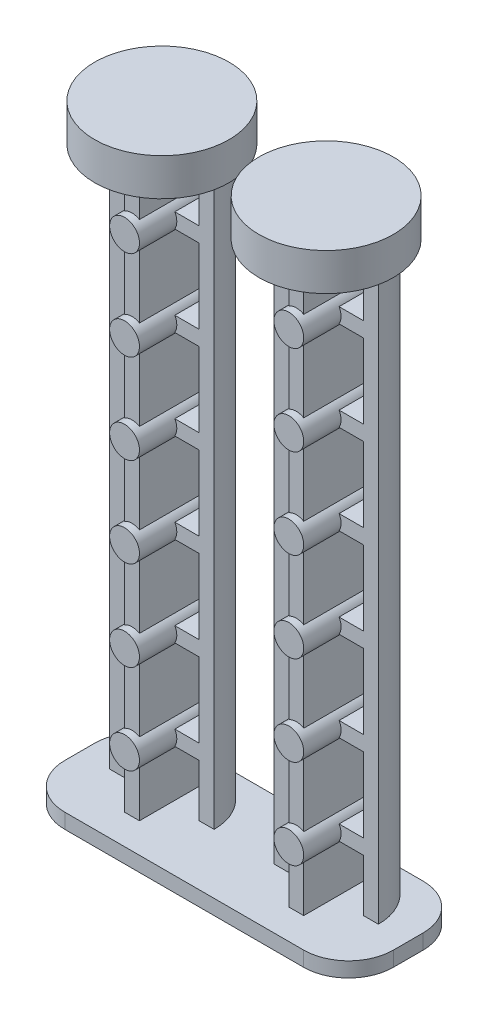
from build123d import *

# Parameters (mm, degrees)
SKETCH2_R           = 9
BOSS_EXTRUDE1_DEPTH = 5
BOSS_EXTRUDE2_DEPTH = 76
BOSS_EXTRUDE3_REACH = 86.599
SKETCH4_R           = 2
BOSS_EXTRUDE4_DEPTH = 2
RIB4_REACH          = 88.845
SKETCH9_WALLS_W     = 2
SKETCH9_WALLS_H     = 181.689377914
SKETCH9_WALLS_H_2   = 183.689377914
RIB5_REACH          = 88.337
SKETCH10_WALLS_W    = 177.673101554
SKETCH10_WALLS_H    = 2


with BuildPart() as part:
    # Sketch2 → Boss-Extrude1 (new body)
    with BuildSketch(Plane(origin=(0, 0, 0), x_dir=(1, 0, 0), z_dir=(0, 1, 0))):
        with Locations(Location((-11, 0, 0), (0, 0, 270))):
            Circle(SKETCH2_R)
    extrude(amount=-BOSS_EXTRUDE1_DEPTH)

    # Sketch3 → Boss-Extrude2 (add)
    with BuildSketch(Plane.XZ.offset(5)):
        with BuildLine():
            Line((-4, 0), (-6, 0))
            ThreePointArc((-6, 0), (-11, -5), (-16, 0))
            Line((-16, 0), (-18, 0))
            ThreePointArc((-18, 0), (-11, -7), (-4, 0))
        make_face()
    extrude(amount=BOSS_EXTRUDE2_DEPTH)

    # Sketch4 → Boss-Extrude3 (add, up to next)
    with BuildSketch(Plane.XY.offset(5), mode=Mode.PRIVATE) as boss_extrude3_sk1:
        with Locations((-11, -13)):
            Circle(SKETCH4_R)
    boss_extrude3_tool1 = extrude(boss_extrude3_sk1.sketch, amount=-BOSS_EXTRUDE3_REACH, mode=Mode.PRIVATE) - part.part
    # Sketch4 → Boss-Extrude3 (add, up to next)
    with BuildSketch(Plane.XY.offset(5), mode=Mode.PRIVATE) as boss_extrude3_sk2:
        with Locations((-11, -25)):
            Circle(SKETCH4_R)
    boss_extrude3_tool2 = extrude(boss_extrude3_sk2.sketch, amount=-BOSS_EXTRUDE3_REACH, mode=Mode.PRIVATE) - part.part
    # Sketch4 → Boss-Extrude3 (add, up to next)
    with BuildSketch(Plane.XY.offset(5), mode=Mode.PRIVATE) as boss_extrude3_sk3:
        with Locations((-11, -37)):
            Circle(SKETCH4_R)
    boss_extrude3_tool3 = extrude(boss_extrude3_sk3.sketch, amount=-BOSS_EXTRUDE3_REACH, mode=Mode.PRIVATE) - part.part
    # Sketch4 → Boss-Extrude3 (add, up to next)
    with BuildSketch(Plane.XY.offset(5), mode=Mode.PRIVATE) as boss_extrude3_sk4:
        with Locations((-11, -49)):
            Circle(SKETCH4_R)
    boss_extrude3_tool4 = extrude(boss_extrude3_sk4.sketch, amount=-BOSS_EXTRUDE3_REACH, mode=Mode.PRIVATE) - part.part
    # Sketch4 → Boss-Extrude3 (add, up to next)
    with BuildSketch(Plane.XY.offset(5), mode=Mode.PRIVATE) as boss_extrude3_sk5:
        with Locations((-11, -61)):
            Circle(SKETCH4_R)
    boss_extrude3_tool5 = extrude(boss_extrude3_sk5.sketch, amount=-BOSS_EXTRUDE3_REACH, mode=Mode.PRIVATE) - part.part
    # Sketch4 → Boss-Extrude3 (add, up to next)
    with BuildSketch(Plane.XY.offset(5), mode=Mode.PRIVATE) as boss_extrude3_sk6:
        with Locations((-11, -73)):
            Circle(SKETCH4_R)
    boss_extrude3_tool6 = extrude(boss_extrude3_sk6.sketch, amount=-BOSS_EXTRUDE3_REACH, mode=Mode.PRIVATE) - part.part
    add(boss_extrude3_tool1.solids().sort_by_distance((-11, -13, 5))[0])
    add(boss_extrude3_tool2.solids().sort_by_distance((-11, -25, 5))[0])
    add(boss_extrude3_tool3.solids().sort_by_distance((-11, -37, 5))[0])
    add(boss_extrude3_tool4.solids().sort_by_distance((-11, -49, 5))[0])
    add(boss_extrude3_tool5.solids().sort_by_distance((-11, -61, 5))[0])
    add(boss_extrude3_tool6.solids().sort_by_distance((-11, -73, 5))[0])

    # Sketch5 → Boss-Extrude4 (add)
    with BuildSketch(Plane.XZ.offset(81)):
        with BuildLine():
            Line((16, 8), (-16, 8))
            ThreePointArc((-16, 8), (-20.242640687, 6.242640687), (-22, 2))
            Line((-22, 2), (-22, -2))
            ThreePointArc((-22, -2), (-20.242640687, -6.242640687), (-16, -8))
            Line((-16, -8), (16, -8))
            ThreePointArc((16, -8), (20.242640687, -6.242640687), (22, -2))
            Line((22, -2), (22, 2))
            ThreePointArc((22, 2), (20.242640687, 6.242640687), (16, 8))
        make_face()
    extrude(amount=BOSS_EXTRUDE4_DEPTH)

    # Sketch9 walls → Rib4 (add, up to next)
    with BuildSketch(Plane.XY.offset(4), mode=Mode.PRIVATE) as rib4_sk1:
        with Locations((-11, -8)):
            Rectangle(SKETCH9_WALLS_W, SKETCH9_WALLS_H)
    rib4_tool1 = extrude(rib4_sk1.sketch, amount=-RIB4_REACH, mode=Mode.PRIVATE) - part.part
    # Sketch9 walls → Rib4 (add, up to next)
    with BuildSketch(Plane.XY.offset(4), mode=Mode.PRIVATE) as rib4_sk2:
        with Locations((-11, -19)):
            Rectangle(SKETCH9_WALLS_W, SKETCH9_WALLS_H_2)
    rib4_tool2 = extrude(rib4_sk2.sketch, amount=-RIB4_REACH, mode=Mode.PRIVATE) - part.part
    # Sketch9 walls → Rib4 (add, up to next)
    with BuildSketch(Plane.XY.offset(4), mode=Mode.PRIVATE) as rib4_sk3:
        with Locations((-11, -31)):
            Rectangle(SKETCH9_WALLS_W, SKETCH9_WALLS_H_2)
    rib4_tool3 = extrude(rib4_sk3.sketch, amount=-RIB4_REACH, mode=Mode.PRIVATE) - part.part
    # Sketch9 walls → Rib4 (add, up to next)
    with BuildSketch(Plane.XY.offset(4), mode=Mode.PRIVATE) as rib4_sk4:
        with Locations((-11, -43)):
            Rectangle(SKETCH9_WALLS_W, SKETCH9_WALLS_H_2)
    rib4_tool4 = extrude(rib4_sk4.sketch, amount=-RIB4_REACH, mode=Mode.PRIVATE) - part.part
    # Sketch9 walls → Rib4 (add, up to next)
    with BuildSketch(Plane.XY.offset(4), mode=Mode.PRIVATE) as rib4_sk5:
        with Locations((-11, -55)):
            Rectangle(SKETCH9_WALLS_W, SKETCH9_WALLS_H_2)
    rib4_tool5 = extrude(rib4_sk5.sketch, amount=-RIB4_REACH, mode=Mode.PRIVATE) - part.part
    # Sketch9 walls → Rib4 (add, up to next)
    with BuildSketch(Plane.XY.offset(4), mode=Mode.PRIVATE) as rib4_sk6:
        with Locations((-11, -67)):
            Rectangle(SKETCH9_WALLS_W, SKETCH9_WALLS_H_2)
    rib4_tool6 = extrude(rib4_sk6.sketch, amount=-RIB4_REACH, mode=Mode.PRIVATE) - part.part
    # Sketch9 walls → Rib4 (add, up to next)
    with BuildSketch(Plane.XY.offset(4), mode=Mode.PRIVATE) as rib4_sk7:
        with Locations((-11, -78)):
            Rectangle(SKETCH9_WALLS_W, SKETCH9_WALLS_H)
    rib4_tool7 = extrude(rib4_sk7.sketch, amount=-RIB4_REACH, mode=Mode.PRIVATE) - part.part
    add(rib4_tool1.solids().sort_by_distance((-11, -8, 4))[0])
    add(rib4_tool2.solids().sort_by_distance((-11, -19, 4))[0])
    add(rib4_tool3.solids().sort_by_distance((-11, -31, 4))[0])
    add(rib4_tool4.solids().sort_by_distance((-11, -43, 4))[0])
    add(rib4_tool5.solids().sort_by_distance((-11, -55, 4))[0])
    add(rib4_tool6.solids().sort_by_distance((-11, -67, 4))[0])
    add(rib4_tool7.solids().sort_by_distance((-11, -78, 4))[0])

    # Sketch10 walls → Rib5 (add, up to next)
    with BuildSketch(Plane.XY, mode=Mode.PRIVATE) as rib5_sk1:
        with Locations((-14.5, -73)):
            Rectangle(SKETCH10_WALLS_W, SKETCH10_WALLS_H)
    rib5_tool1 = extrude(rib5_sk1.sketch, amount=-RIB5_REACH, mode=Mode.PRIVATE) - part.part
    # Sketch10 walls → Rib5 (add, up to next)
    with BuildSketch(Plane.XY, mode=Mode.PRIVATE) as rib5_sk2:
        with Locations((-7.5, -73)):
            Rectangle(SKETCH10_WALLS_W, SKETCH10_WALLS_H)
    rib5_tool2 = extrude(rib5_sk2.sketch, amount=-RIB5_REACH, mode=Mode.PRIVATE) - part.part
    # Sketch10 walls → Rib5 (add, up to next)
    with BuildSketch(Plane.XY, mode=Mode.PRIVATE) as rib5_sk3:
        with Locations((-14.5, -61)):
            Rectangle(SKETCH10_WALLS_W, SKETCH10_WALLS_H)
    rib5_tool3 = extrude(rib5_sk3.sketch, amount=-RIB5_REACH, mode=Mode.PRIVATE) - part.part
    # Sketch10 walls → Rib5 (add, up to next)
    with BuildSketch(Plane.XY, mode=Mode.PRIVATE) as rib5_sk4:
        with Locations((-7.5, -61)):
            Rectangle(SKETCH10_WALLS_W, SKETCH10_WALLS_H)
    rib5_tool4 = extrude(rib5_sk4.sketch, amount=-RIB5_REACH, mode=Mode.PRIVATE) - part.part
    # Sketch10 walls → Rib5 (add, up to next)
    with BuildSketch(Plane.XY, mode=Mode.PRIVATE) as rib5_sk5:
        with Locations((-14.5, -49)):
            Rectangle(SKETCH10_WALLS_W, SKETCH10_WALLS_H)
    rib5_tool5 = extrude(rib5_sk5.sketch, amount=-RIB5_REACH, mode=Mode.PRIVATE) - part.part
    # Sketch10 walls → Rib5 (add, up to next)
    with BuildSketch(Plane.XY, mode=Mode.PRIVATE) as rib5_sk6:
        with Locations((-7.5, -49)):
            Rectangle(SKETCH10_WALLS_W, SKETCH10_WALLS_H)
    rib5_tool6 = extrude(rib5_sk6.sketch, amount=-RIB5_REACH, mode=Mode.PRIVATE) - part.part
    # Sketch10 walls → Rib5 (add, up to next)
    with BuildSketch(Plane.XY, mode=Mode.PRIVATE) as rib5_sk7:
        with Locations((-14.5, -37)):
            Rectangle(SKETCH10_WALLS_W, SKETCH10_WALLS_H)
    rib5_tool7 = extrude(rib5_sk7.sketch, amount=-RIB5_REACH, mode=Mode.PRIVATE) - part.part
    # Sketch10 walls → Rib5 (add, up to next)
    with BuildSketch(Plane.XY, mode=Mode.PRIVATE) as rib5_sk8:
        with Locations((-7.5, -37)):
            Rectangle(SKETCH10_WALLS_W, SKETCH10_WALLS_H)
    rib5_tool8 = extrude(rib5_sk8.sketch, amount=-RIB5_REACH, mode=Mode.PRIVATE) - part.part
    # Sketch10 walls → Rib5 (add, up to next)
    with BuildSketch(Plane.XY, mode=Mode.PRIVATE) as rib5_sk9:
        with Locations((-14.5, -25)):
            Rectangle(SKETCH10_WALLS_W, SKETCH10_WALLS_H)
    rib5_tool9 = extrude(rib5_sk9.sketch, amount=-RIB5_REACH, mode=Mode.PRIVATE) - part.part
    # Sketch10 walls → Rib5 (add, up to next)
    with BuildSketch(Plane.XY, mode=Mode.PRIVATE) as rib5_sk10:
        with Locations((-7.5, -25)):
            Rectangle(SKETCH10_WALLS_W, SKETCH10_WALLS_H)
    rib5_tool10 = extrude(rib5_sk10.sketch, amount=-RIB5_REACH, mode=Mode.PRIVATE) - part.part
    # Sketch10 walls → Rib5 (add, up to next)
    with BuildSketch(Plane.XY, mode=Mode.PRIVATE) as rib5_sk11:
        with Locations((-14.5, -13)):
            Rectangle(SKETCH10_WALLS_W, SKETCH10_WALLS_H)
    rib5_tool11 = extrude(rib5_sk11.sketch, amount=-RIB5_REACH, mode=Mode.PRIVATE) - part.part
    # Sketch10 walls → Rib5 (add, up to next)
    with BuildSketch(Plane.XY, mode=Mode.PRIVATE) as rib5_sk12:
        with Locations((-7.5, -13)):
            Rectangle(SKETCH10_WALLS_W, SKETCH10_WALLS_H)
    rib5_tool12 = extrude(rib5_sk12.sketch, amount=-RIB5_REACH, mode=Mode.PRIVATE) - part.part
    add(rib5_tool1.solids().sort_by_distance((-14.5, -73, 0))[0])
    add(rib5_tool2.solids().sort_by_distance((-7.5, -73, 0))[0])
    add(rib5_tool3.solids().sort_by_distance((-14.5, -61, 0))[0])
    add(rib5_tool4.solids().sort_by_distance((-7.5, -61, 0))[0])
    add(rib5_tool5.solids().sort_by_distance((-14.5, -49, 0))[0])
    add(rib5_tool6.solids().sort_by_distance((-7.5, -49, 0))[0])
    add(rib5_tool7.solids().sort_by_distance((-14.5, -37, 0))[0])
    add(rib5_tool8.solids().sort_by_distance((-7.5, -37, 0))[0])
    add(rib5_tool9.solids().sort_by_distance((-14.5, -25, 0))[0])
    add(rib5_tool10.solids().sort_by_distance((-7.5, -25, 0))[0])
    add(rib5_tool11.solids().sort_by_distance((-14.5, -13, 0))[0])
    add(rib5_tool12.solids().sort_by_distance((-7.5, -13, 0))[0])

    # Mirror5: part across plane


with BuildPart() as part_1:
    add(part.part)
    add(part.part.mirror(Plane(origin=(0, 0, 0), x_dir=(0, 0, 1), z_dir=(1, 0, 0))))


solid = part_1.part
